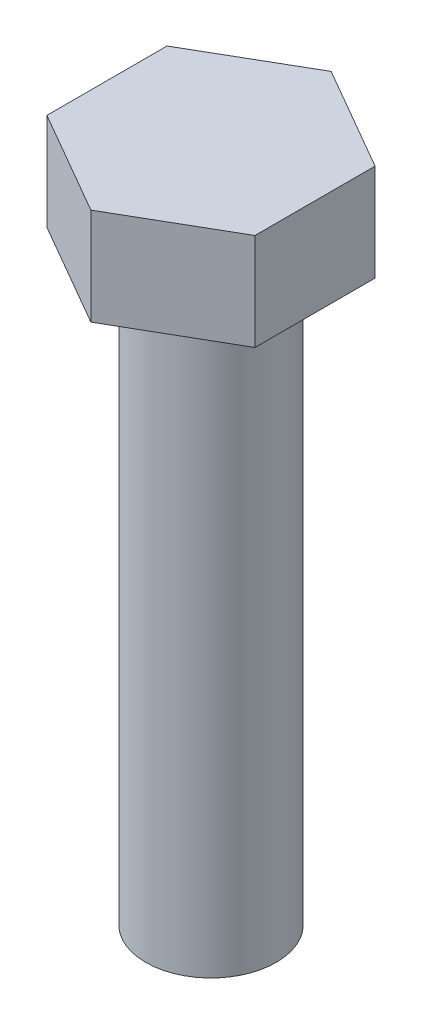
from build123d import *

# Parameters (mm, degrees)
BOSS_EXTRUDE1_DEPTH = 5.08
SKETCH2_R           = 3.4163
BOSS_EXTRUDE2_DEPTH = 30.48


with BuildPart() as part:
    # Sketch1 → Boss-Extrude1 (new body)
    with BuildSketch(Plane(origin=(0, 0, 0), x_dir=(1, 0, 0), z_dir=(0, 1, 0))):
        Polygon((0, 6.291154943), (-5.4483, 3.145577472), (-5.4483, -3.145577472), (0, -6.291154943), (5.4483, -3.145577472), (5.4483, 3.145577472), align=None)
    extrude(amount=BOSS_EXTRUDE1_DEPTH)

    # Sketch2 → Boss-Extrude2 (add)
    with BuildSketch(Plane.XZ):
        with Locations(Location((0, 0, 0), (0, 0, 90))):
            Circle(SKETCH2_R)
    extrude(amount=BOSS_EXTRUDE2_DEPTH)


solid = part.part
